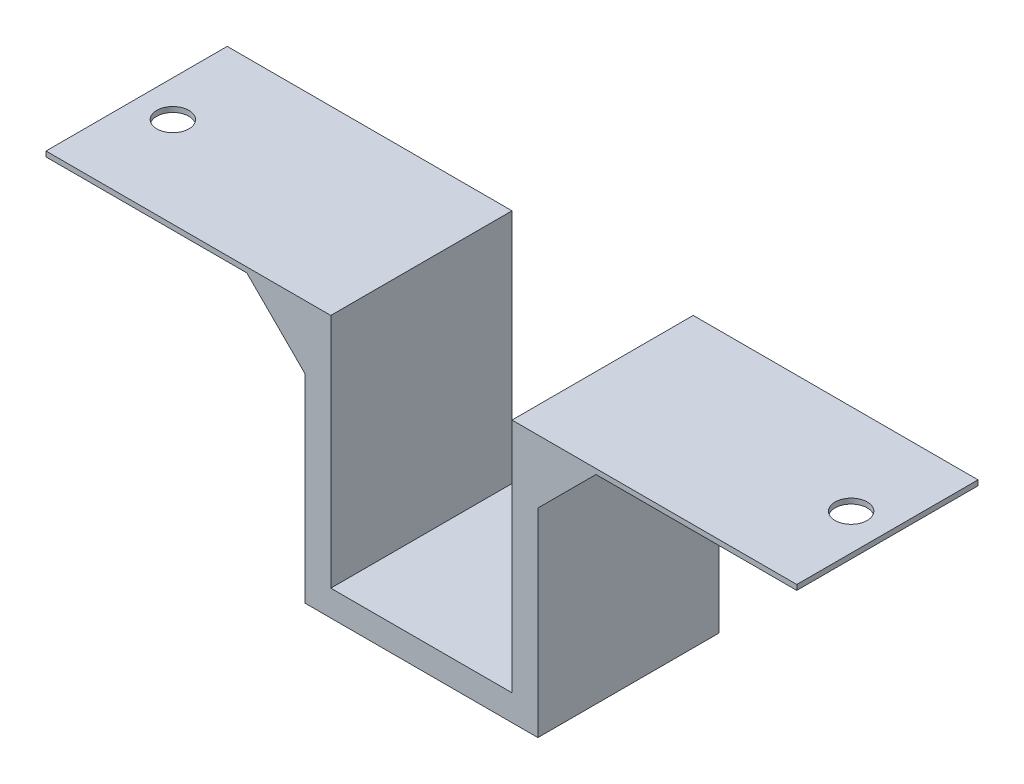
from build123d import *

# Parameters (mm, degrees)
BOSS_EXTRUDE1_DEPTH = 44.45
SKETCH2_R           = 3.937
CUT_EXTRUDE1_DEPTH  = 121.103292327


with BuildPart() as part:
    # Sketch1 → Boss-Extrude1 (new body)
    with BuildSketch(Plane.XY):
        Polygon((-22.225, 0), (22.225, 0), (22.225, 57.9374), (28.575, 57.9374), (92.075, 57.9374), (92.075, 56.6674), (42.818141465, 56.6674), (28.575, 42.424258535), (28.575, -6.35), (-28.575, -6.35), (-28.575, 42.424258535), (-42.818141465, 56.6674), (-92.075, 56.6674), (-92.075, 57.9374), (-28.575, 57.9374), (-22.225, 57.9374), align=None)
    extrude(amount=BOSS_EXTRUDE1_DEPTH)

    # Sketch2 → Cut-Extrude1 (cut, through all)
    with BuildSketch(Plane.XZ.offset(-56.6674)):
        with Locations((83.185, 22.225)):
            Circle(SKETCH2_R)
        with Locations(Location((-83.185, 22.225, 0), (0, 0, 180))):
            Circle(SKETCH2_R)
    extrude(amount=-CUT_EXTRUDE1_DEPTH, mode=Mode.SUBTRACT)


solid = part.part
